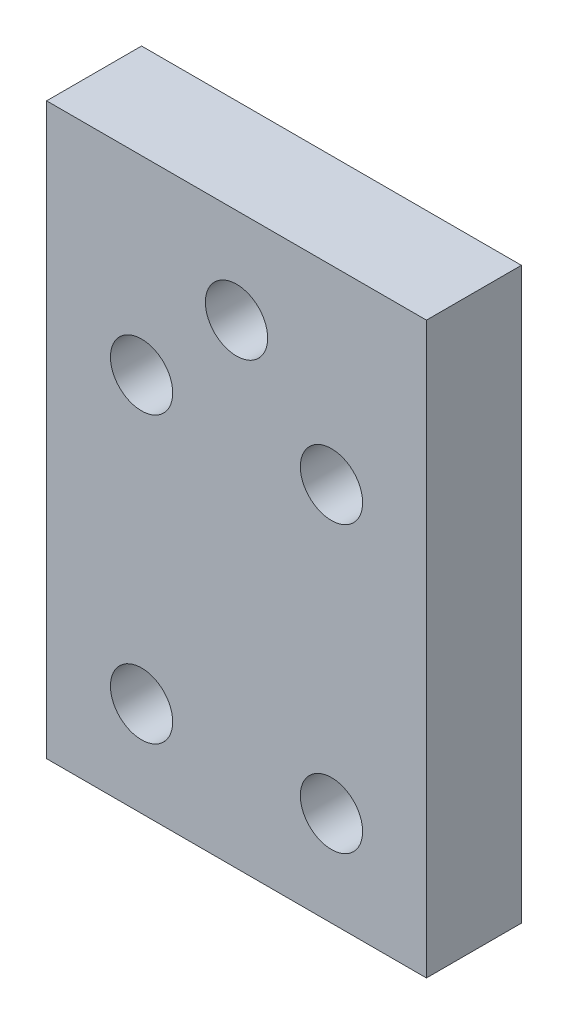
from build123d import *

# Parameters (mm, degrees)
SKETCH1_W           = 25.4
SKETCH1_H           = 38.1
SKETCH1_R           = 2.0828
BOSS_EXTRUDE1_DEPTH = 6.35
SKETCH2_R           = 0.635
CUT_EXTRUDE1_DEPTH  = 3.556


with BuildPart() as part:
    # Sketch1 → Boss-Extrude1 (new body)
    with BuildSketch(Plane.XY):
        with Locations((12.7, 31.75)):
            Rectangle(SKETCH1_W, SKETCH1_H)
        with Locations((6.35, 19.05)):
            Circle(SKETCH1_R, mode=Mode.SUBTRACT)
        with Locations((6.35, 38.1)):
            Circle(SKETCH1_R, mode=Mode.SUBTRACT)
        with Locations((12.7, 44.45)):
            Circle(SKETCH1_R, mode=Mode.SUBTRACT)
        with Locations(Location((19.05, 19.05, 0), (0, 0, 180))):
            Circle(SKETCH1_R, mode=Mode.SUBTRACT)
        with Locations(Location((19.05, 38.1, 0), (0, 0, 180))):
            Circle(SKETCH1_R, mode=Mode.SUBTRACT)
    extrude(amount=BOSS_EXTRUDE1_DEPTH)

    # Sketch2 → Cut-Extrude1 (cut)
    with BuildSketch(Plane.XZ.offset(-12.7)):
        with Locations(Location((5.334, 3.175, 0), (0, 0, 270))):
            Circle(SKETCH2_R)
        with Locations(Location((20.066, 3.175, 0), (0, 0, 90))):
            Circle(SKETCH2_R)
    extrude(amount=-CUT_EXTRUDE1_DEPTH, mode=Mode.SUBTRACT)


solid = part.part
